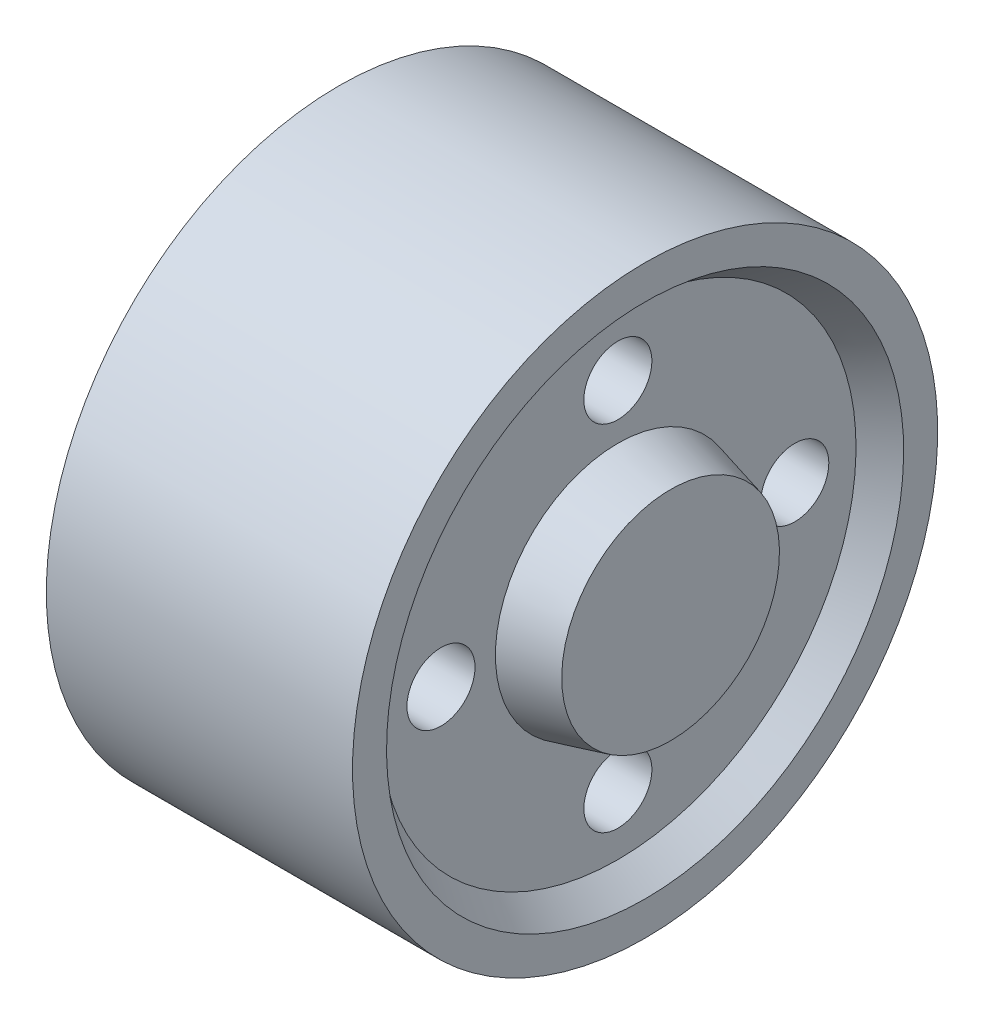
from build123d import *

# Parameters (mm, degrees)
SKETCH2_R          = 5
CUT_EXTRUDE2_DEPTH = 50


with BuildPart() as part:
    # Sketch1 → Revolve1 (revolve)
    with BuildSketch(Plane.XY, mode=Mode.PRIVATE) as revolve1_sk:
        Polygon((0, 0), (0, 16), (7.745966692, 18), (7.745966692, 35), (3.745966692, 38), (3.745966692, 43), (48.745966692, 43), (48.745966692, 38), (44.745966692, 35), (44.745966692, 18), (52.491933385, 16), (52.491933385, 0), align=None)
    revolve(revolve1_sk.sketch.rotate(Axis((0, 0, 0), (1, 0, 0)), 180), axis=Axis((0, 0, 0), (1, 0, 0)))

    # Sketch2 → Cut-Extrude2 (cut)
    with BuildSketch(Plane(origin=(52.491933385, 0, 0), x_dir=(0, 0, -1), z_dir=(1, 0, 0))):
        with Locations(Location((0, 26, 0), (0, 0, 90))):
            Circle(SKETCH2_R)
        with Locations(Location((26, 0, 0), (0, 0, 90))):
            Circle(SKETCH2_R)
        with Locations(Location((0, -26, 0), (0, 0, 90))):
            Circle(SKETCH2_R)
        with Locations(Location((-26, 0, 0), (0, 0, 90))):
            Circle(SKETCH2_R)
    extrude(amount=-CUT_EXTRUDE2_DEPTH, mode=Mode.SUBTRACT)


solid = part.part
